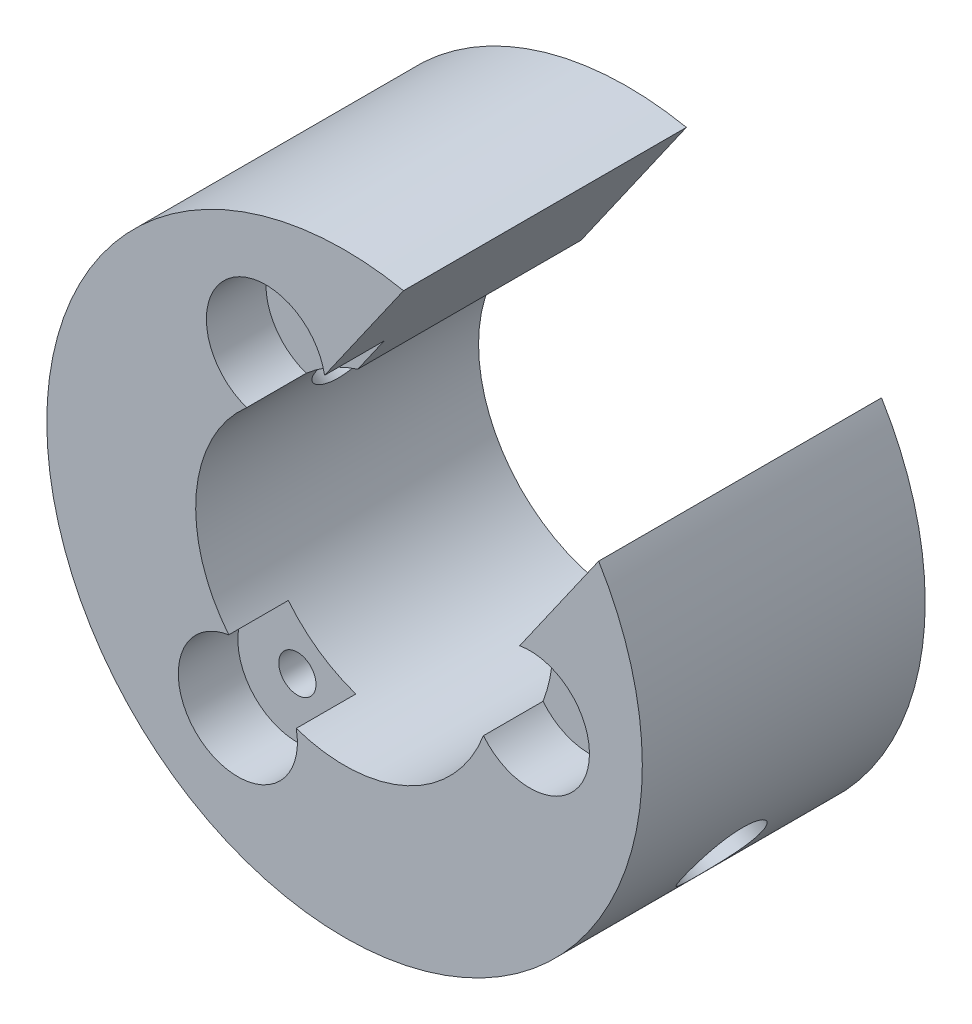
from build123d import *

# Parameters (mm, degrees)
SKETCH1_R               = 0.625
BOSS_EXTRUDE1_DEPTH     = 9.5
CUT_EXTRUDE1_DEPTH      = 28.258192056
CUT_EXTRUDE1_DEPTH_BACK = 28.258192056
SKETCH3_R               = 1.325
CUT_EXTRUDE2_START      = -9.5
SKETCH6_R               = 2
CUT_EXTRUDE2_DEPTH      = 2


with BuildPart() as part:
    # Sketch1 → Boss-Extrude1 (new body)
    with BuildSketch(Plane.XY):
        with BuildLine():
            Line((-10.029848506, 2.747640173), (-6.493662943, 7.797836537))
            ThreePointArc((-6.493662943, 7.797836537), (-14.209734002, -10.195642148), (0.059553412, 3.209225046))
            Line((0.059553412, 3.209225046), (-3.476632152, -1.840971318))
            ThreePointArc((-3.476632152, -1.840971318), (-11.34185182, -6.099881927), (-10.029848506, 2.747640173))
        make_face()
        with Locations((-11.114657585, 3.658851871)):
            Circle(SKETCH1_R, mode=Mode.SUBTRACT)
        with Locations((-2.249346687, -2.548705649)):
            Circle(SKETCH1_R, mode=Mode.SUBTRACT)
        with Locations((-12.057904643, -7.122511339)):
            Circle(SKETCH1_R, mode=Mode.SUBTRACT)
    extrude(amount=BOSS_EXTRUDE1_DEPTH)

    # Sketch3 → Cut-Extrude1 (cut, two sides: drawn at the far end of the back side and taken through both)
    with BuildSketch(Plane(origin=(-12.936010228, 9.057891876, 0), x_dir=(0, 0, 1), z_dir=(-0.8191520442889951, 0.5735764363510415, 0)).offset(-CUT_EXTRUDE1_DEPTH_BACK)):
        with Locations(Location((5, -6.519345212, 0), (0, 0, 270))):
            Circle(SKETCH3_R)
    extrude(amount=CUT_EXTRUDE1_DEPTH + CUT_EXTRUDE1_DEPTH_BACK, mode=Mode.SUBTRACT)

    # Sketch6 → Cut-Extrude2 (cut)
    with BuildSketch(Plane(origin=(0, 0, 0), x_dir=(-1, 0, 0), z_dir=(0, 0, -1)).offset(CUT_EXTRUDE2_START)):
        with Locations((11.114657585, 3.658851871)):
            Circle(SKETCH6_R)
        with Locations((12.057904643, -7.122511339)):
            Circle(SKETCH6_R)
        with Locations((2.249346687, -2.548705649)):
            Circle(SKETCH6_R)
    extrude(amount=CUT_EXTRUDE2_DEPTH, mode=Mode.SUBTRACT)


solid = part.part
